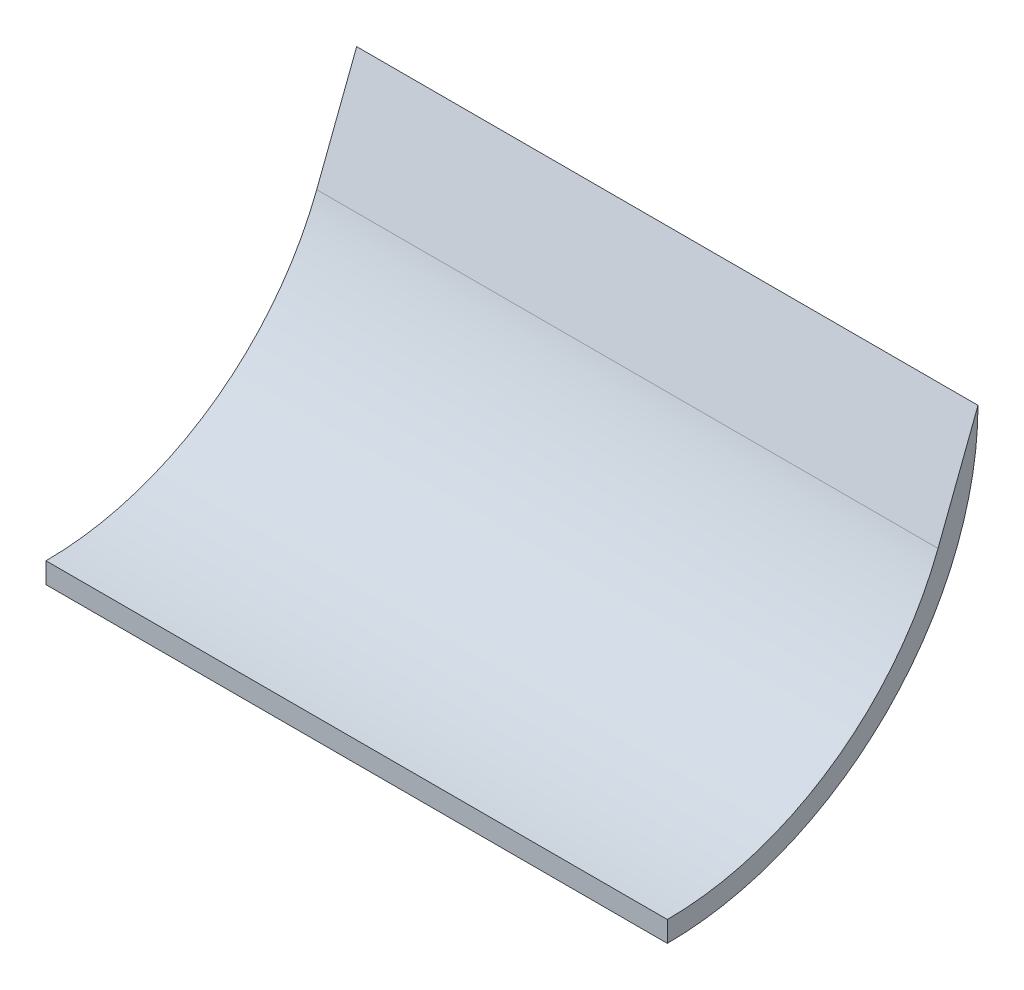
from build123d import *

# Parameters (mm, degrees)
ESBO_O2_R                  = 45
RESSALTO_EXTRUS_O3_DEPTH   = 45
CORTE_EXTRUS_O1_DEPTH      = 136
CORTE_EXTRUS_O1_DEPTH_BACK = 136
ESBO_O5_R                  = 42
CORTE_EXTRUS_O2_DEPTH      = 136
CORTE_EXTRUS_O2_DEPTH_BACK = 136


with BuildPart() as part:
    # Esboço2 → Ressalto-extrusão3 (new, symmetric)
    with BuildSketch(Plane(origin=(0, 0, 0), x_dir=(0, 0, -1), z_dir=(1, 0, 0))):
        with Locations(Location((-45, 45, 0), (0, 0, 180))):
            Circle(ESBO_O2_R)
    extrude(amount=RESSALTO_EXTRUS_O3_DEPTH, both=True)

    # Esboço5 → Corte-extrusão1 (cut, two sides: drawn at the far end of the back side and taken through both)
    with BuildSketch(Plane(origin=(0, 0, 0), x_dir=(0, 0, -1), z_dir=(1, 0, 0)).offset(-CORTE_EXTRUS_O1_DEPTH_BACK)):
        with Locations((-45, 45)):
            Circle(ESBO_O5_R)
    extrude(amount=CORTE_EXTRUS_O1_DEPTH + CORTE_EXTRUS_O1_DEPTH_BACK, mode=Mode.SUBTRACT)

    # Esboço6 → Corte-extrusão2 (cut, two sides: drawn at the far end of the back side and taken through both)
    with BuildSketch(Plane(origin=(0, 0, 0), x_dir=(0, 0, -1), z_dir=(1, 0, 0)).offset(-CORTE_EXTRUS_O2_DEPTH_BACK)):
        Polygon((-45, 45), (-45, 0), (-90, 0), (-90, 45), (-90, 90), (-45, 90), (-3, 90), (0, 90), (0, 45), (-5.810711404, 29.893721195), align=None)
    extrude(amount=CORTE_EXTRUS_O2_DEPTH + CORTE_EXTRUS_O2_DEPTH_BACK, mode=Mode.SUBTRACT)


solid = part.part
